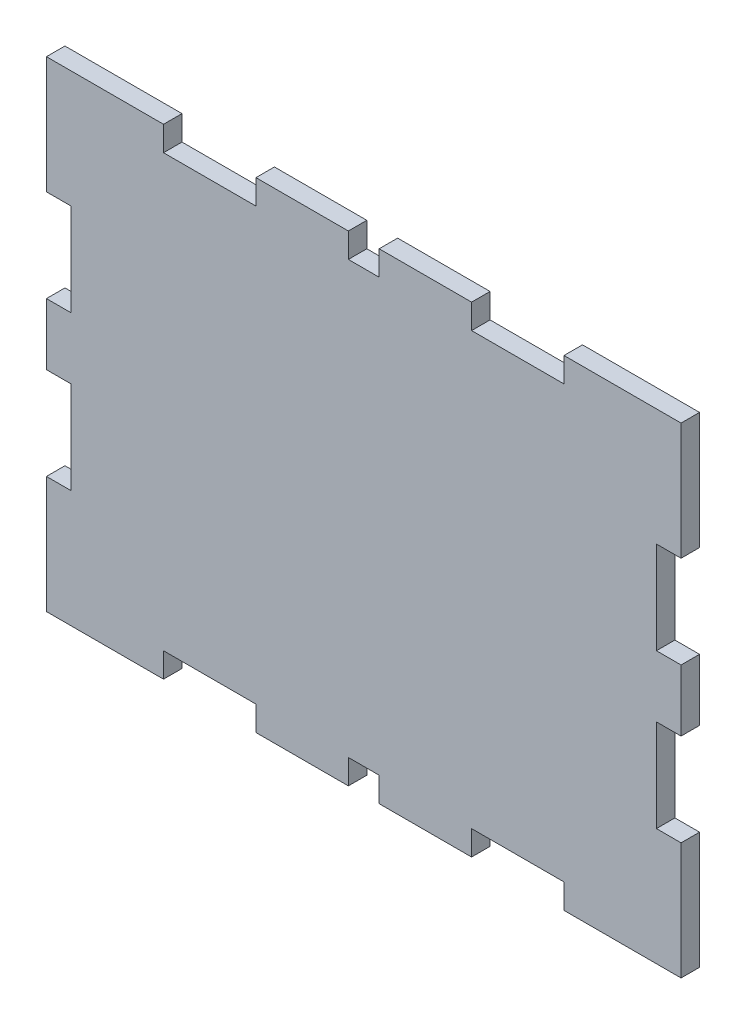
from build123d import *

# Parameters (mm, degrees)
SKETCH1_W           = 95
SKETCH1_H           = 70
BOSS_EXTRUDE1_DEPTH = 3
SKETCH2_W           = 4
SKETCH2_H           = 10
SKETCH2_W_2         = 15
SKETCH2_H_2         = 4
BOSS_EXTRUDE2_DEPTH = 3


with BuildPart() as part:
    # Sketch1 → Boss-Extrude1 (new body)
    with BuildSketch(Plane.XY):
        with Locations((-47.5, 35)):
            Rectangle(SKETCH1_W, SKETCH1_H)
    extrude(amount=BOSS_EXTRUDE1_DEPTH)

    # Sketch2 → Boss-Extrude2 (add)
    with BuildSketch(Plane.XY.offset(3)):
        Polygon((0, 15), (4, 15), (4, 0), (4, -4), (0, -4), (-15, -4), (-15, 0), (0, 0), align=None)
        with Locations((2, 35)):
            Rectangle(SKETCH2_W, SKETCH2_H)
        Polygon((-95, 70), (-80, 70), (-80, 74), (-95, 74), (-99, 74), (-99, 70), (-99, 55), (-95, 55), align=None)
        Polygon((0, 74), (-15, 74), (-15, 70), (0, 70), (0, 55), (4, 55), (4, 70), (4, 74), align=None)
        with Locations((-57.5, 72)):
            Rectangle(SKETCH2_W_2, SKETCH2_H_2)
        with Locations((-37.5, 72)):
            Rectangle(SKETCH2_W_2, SKETCH2_H_2)
        with Locations((-37.5, -2)):
            Rectangle(SKETCH2_W_2, SKETCH2_H_2)
        with Locations((-57.5, -2)):
            Rectangle(SKETCH2_W_2, SKETCH2_H_2)
        Polygon((-80, -4), (-95, -4), (-99, -4), (-99, 0), (-99, 15), (-95, 15), (-95, 0), (-80, 0), align=None)
        with Locations((-97, 35)):
            Rectangle(SKETCH2_W, SKETCH2_H)
    extrude(amount=-BOSS_EXTRUDE2_DEPTH)


solid = part.part
